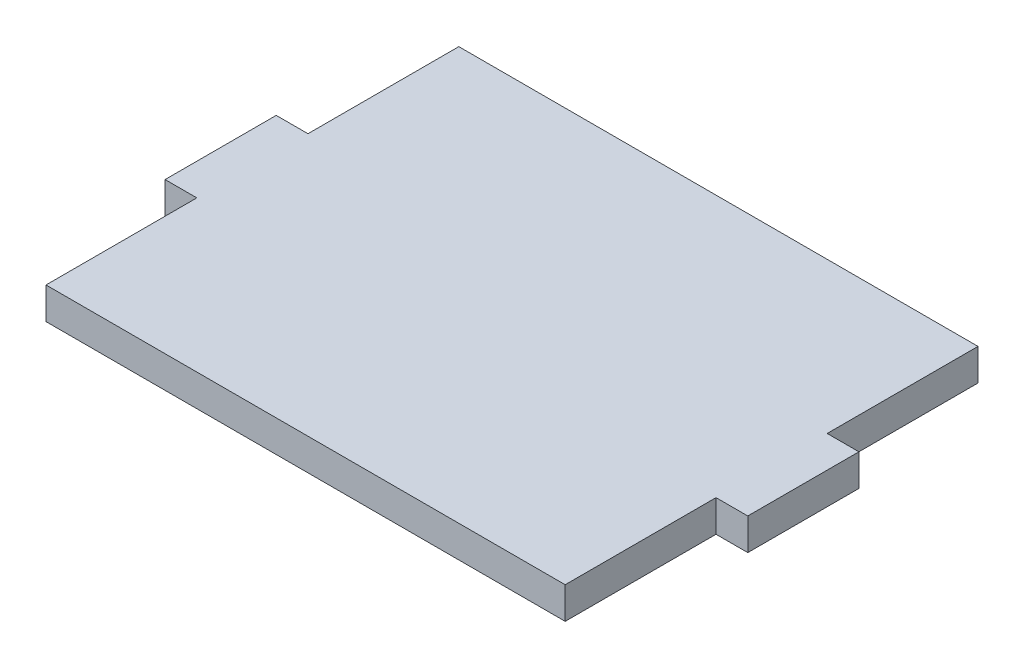
from build123d import *

# Parameters (mm, degrees)
SKETCH1_W           = 32.7
SKETCH1_H           = 26
SKETCH1_W_2         = 2
SKETCH1_H_2         = 7
BOSS_EXTRUDE1_DEPTH = 2


with BuildPart() as part:
    # Sketch1 → Boss-Extrude1 (new body)
    with BuildSketch(Plane(origin=(0, 0, 0), x_dir=(1, 0, 0), z_dir=(0, 1, 0))):
        Rectangle(SKETCH1_W, SKETCH1_H)
        with Locations((-17.35, 0)):
            Rectangle(SKETCH1_W_2, SKETCH1_H_2)
        with Locations((17.35, 0)):
            Rectangle(SKETCH1_W_2, SKETCH1_H_2)
    extrude(amount=BOSS_EXTRUDE1_DEPTH)


solid = part.part
